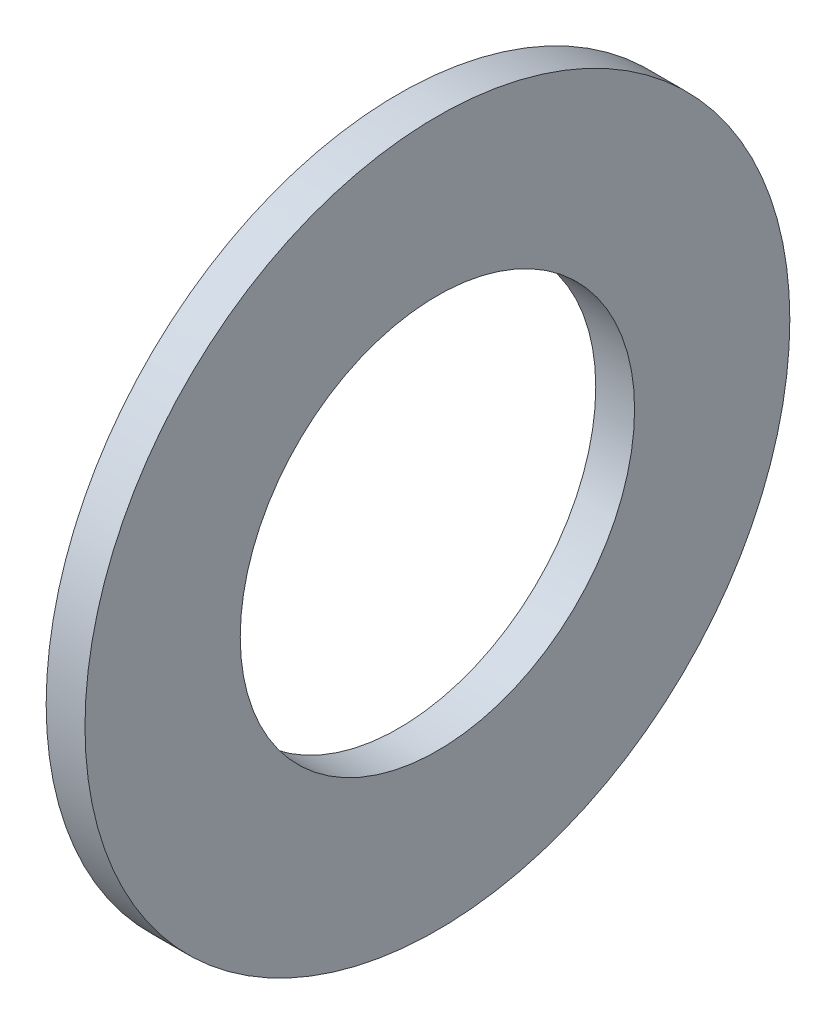
from build123d import *

# Parameters (mm, degrees)
SKETCH1_R           = 45.4
SKETCH1_R_2         = 25.4
BOSS_EXTRUDE1_DEPTH = 5


with BuildPart() as part:
    # Sketch1 → Boss-Extrude1 (new body)
    with BuildSketch(Plane(origin=(0, 0, 0), x_dir=(0, 0, -1), z_dir=(1, 0, 0))):
        Circle(SKETCH1_R)
        Circle(SKETCH1_R_2, mode=Mode.SUBTRACT)
    extrude(amount=BOSS_EXTRUDE1_DEPTH)


solid = part.part
